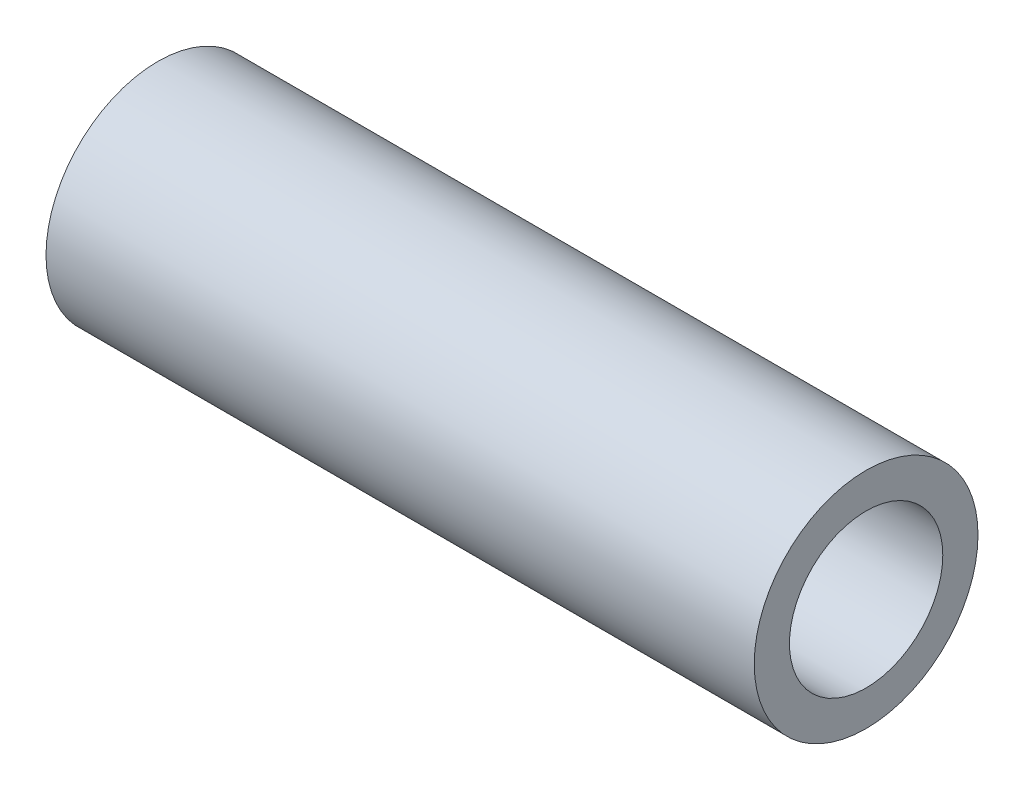
from build123d import *

# Parameters (mm, degrees)
SKETCH1_R           = 4.7625
SKETCH1_R_2         = 3.2639
BOSS_EXTRUDE1_DEPTH = 30.1498


with BuildPart() as part:
    # Sketch1 → Boss-Extrude1 (new body)
    with BuildSketch(Plane(origin=(0, 0, 0), x_dir=(0, 0, -1), z_dir=(1, 0, 0))):
        Circle(SKETCH1_R)
        Circle(SKETCH1_R_2, mode=Mode.SUBTRACT)
    extrude(amount=BOSS_EXTRUDE1_DEPTH)


solid = part.part
